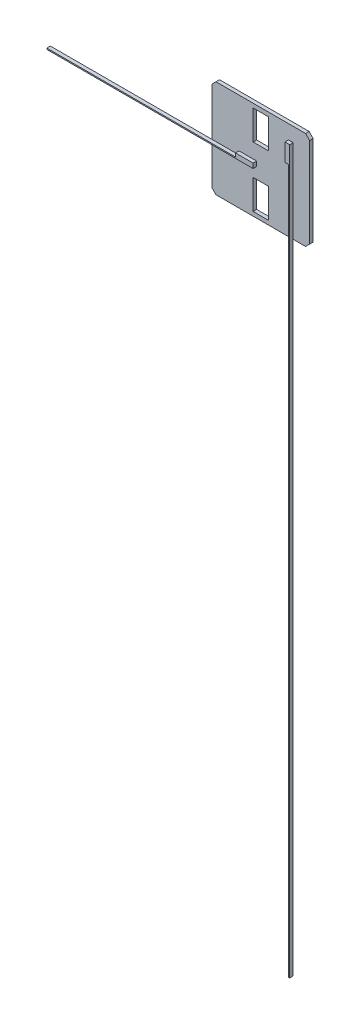
from build123d import *

# Parameters (mm, degrees)
SKETCH1_W           = 83
SKETCH1_H           = 83
BOSS_EXTRUDE1_DEPTH = 3
SKETCH2_W           = 13
SKETCH2_H           = 25
CUT_EXTRUDE1_DEPTH  = 3
CHAMFER1_SIZE       = 3.5
SKETCH3_W           = 15
SKETCH3_H           = 3
SKETCH3_W_2         = 3
SKETCH3_H_2         = 15
BOSS_EXTRUDE2_DEPTH = 3
SKETCH5_W           = 175
SKETCH5_H           = 3
BOSS_EXTRUDE4_DEPTH = 1
SKETCH6_W           = 3
SKETCH6_H           = 612
BOSS_EXTRUDE5_DEPTH = 1


with BuildPart() as part:
    # Sketch1 → Boss-Extrude1 (new body)
    with BuildSketch(Plane.XY):
        Rectangle(SKETCH1_W, SKETCH1_H)
    extrude(amount=BOSS_EXTRUDE1_DEPTH)

    # Sketch2 → Cut-Extrude1 (cut)
    with BuildSketch(Plane.XY.offset(3)):
        with Locations((0, 25.5)):
            Rectangle(SKETCH2_W, SKETCH2_H)
        with Locations((0, -25.5)):
            Rectangle(SKETCH2_W, SKETCH2_H)
    extrude(amount=-CUT_EXTRUDE1_DEPTH, mode=Mode.SUBTRACT)

    # Chamfer1
    chamfer1_edges = [part.edges().sort_by_distance(p)[0] for p in [
        (-41.5, 41.5, 1.5),
        (41.5, 41.5, 1.5),
        (41.5, -41.5, 1.5),
        (-41.5, -41.5, 1.5),
    ]]
    chamfer(chamfer1_edges, length=CHAMFER1_SIZE)

    # Sketch3 → Boss-Extrude2 (add)
    with BuildSketch(Plane.XY.offset(3)):
        with Locations((-11, -1)):
            Rectangle(SKETCH3_W, SKETCH3_H)
        with Locations((25, 22)):
            Rectangle(SKETCH3_W_2, SKETCH3_H_2)
    extrude(amount=BOSS_EXTRUDE2_DEPTH)

    # Sketch5 → Boss-Extrude4 (add)
    with BuildSketch(Plane.XZ.offset(2.5)):
        with Locations((-91, 4.5)):
            Rectangle(SKETCH5_W, SKETCH5_H)
    extrude(amount=BOSS_EXTRUDE4_DEPTH)

    # Sketch6 → Boss-Extrude5 (add)
    with BuildSketch(Plane(origin=(26.5, 0, 0), x_dir=(0, 0, -1), z_dir=(1, 0, 0))):
        with Locations((-4.5, -276.5)):
            Rectangle(SKETCH6_W, SKETCH6_H)
    extrude(amount=BOSS_EXTRUDE5_DEPTH)


solid = part.part
